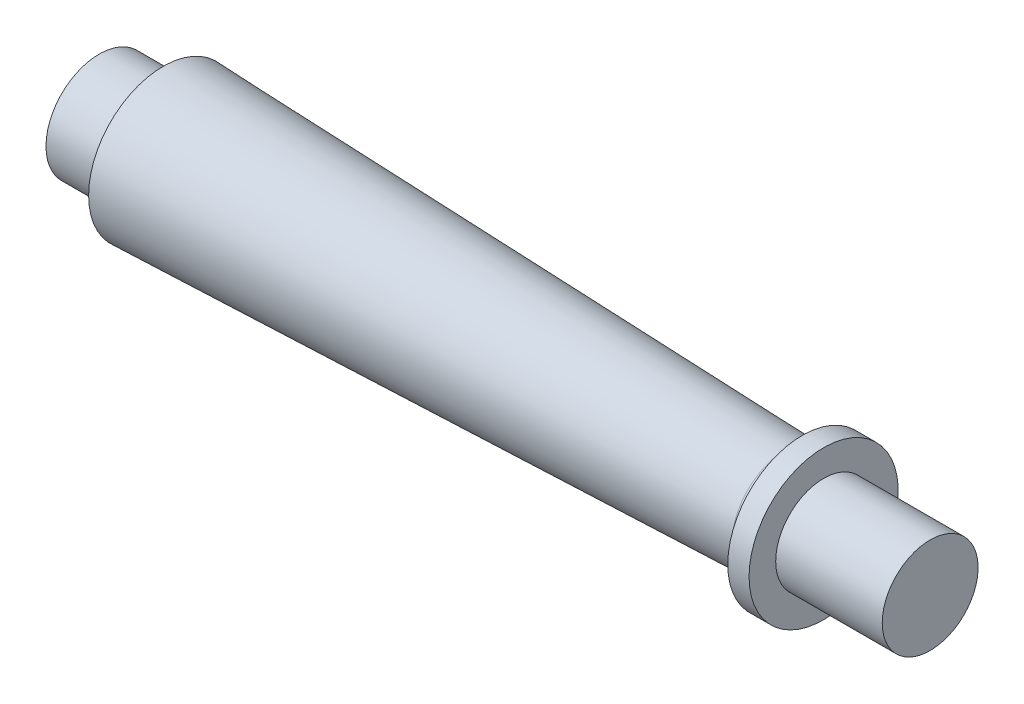
from build123d import *

# Parameters (mm, degrees)
FILLET1_R = 1.5


with BuildPart() as part:
    # Sketch2 → Revolve1 (revolve)
    with BuildSketch(Plane.XY, mode=Mode.PRIVATE) as revolve1_sk:
        Polygon((0, 0), (78, 0), (78, 4.5), (68, 4.5), (68, 7), (66, 7), (66, 5), (6, 7), (6, 5), (0, 5), align=None)
    revolve(revolve1_sk.sketch.rotate(Axis((0, 0, 0), (1, 0, 0)), 90), axis=Axis((0, 0, 0), (1, 0, 0)))

    # Fillet1
    fillet1_edges = [part.edges().sort_by_distance(p)[0] for p in [
        (66, 0, -5),
    ]]
    fillet(fillet1_edges, radius=FILLET1_R)


solid = part.part
